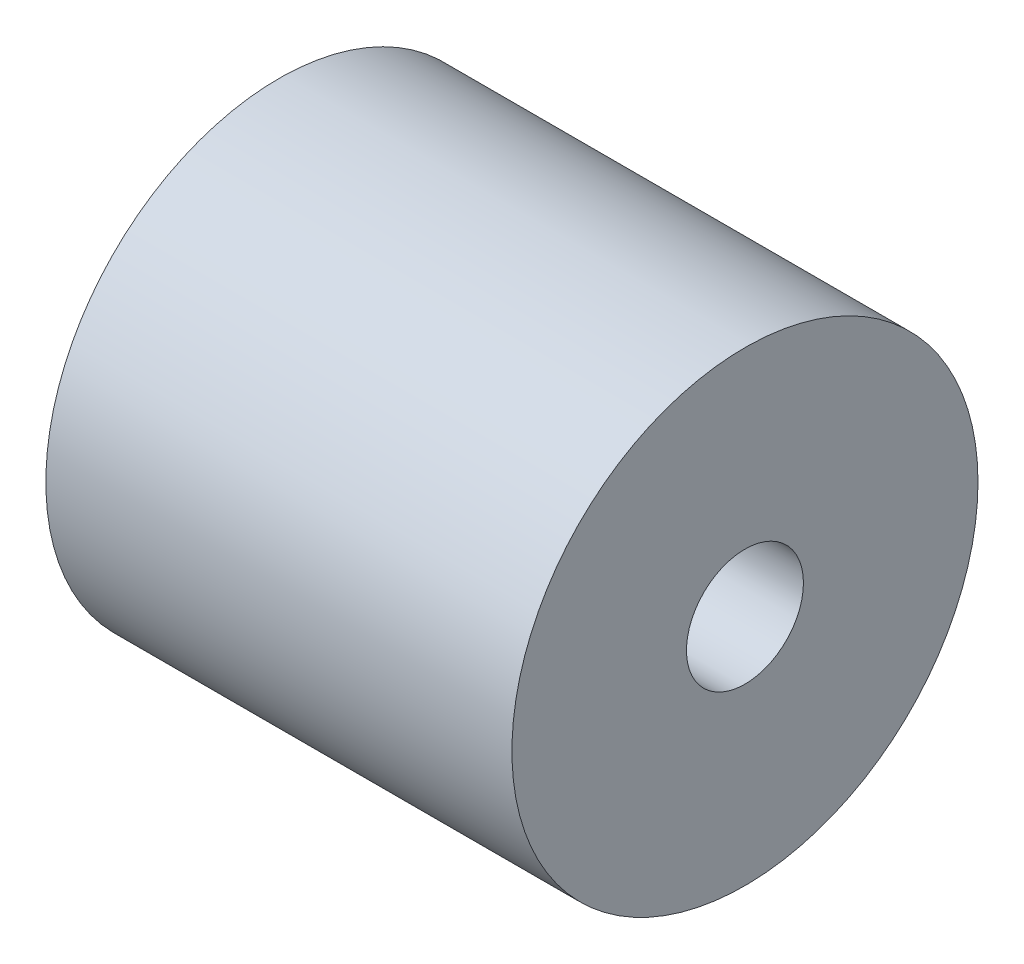
from build123d import *

# Parameters (mm, degrees)
SKETCH1_R           = 101.6
SKETCH1_R_2         = 25.5
BOSS_EXTRUDE1_DEPTH = 203.2


with BuildPart() as part:
    # Sketch1 → Boss-Extrude1 (new body)
    with BuildSketch(Plane(origin=(0, 0, 0), x_dir=(0, 0, -1), z_dir=(1, 0, 0))):
        Circle(SKETCH1_R)
        Circle(SKETCH1_R_2, mode=Mode.SUBTRACT)
    extrude(amount=BOSS_EXTRUDE1_DEPTH)


solid = part.part
